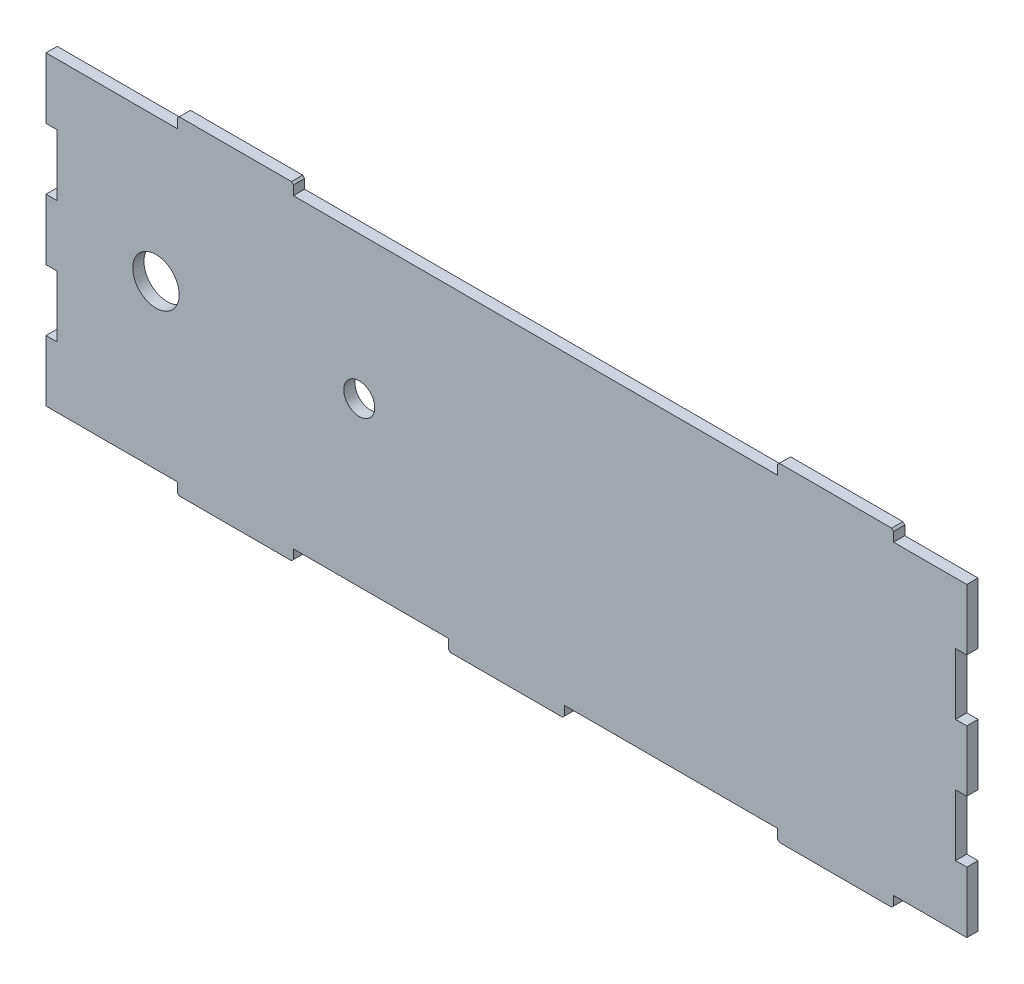
from build123d import *

# Parameters (mm, degrees)
SKETCH1_R           = 6
SKETCH1_R_2         = 4
BOSS_EXTRUDE1_DEPTH = 2.9


with BuildPart() as part:
    # Sketch1 → Boss-Extrude1 (new body)
    with BuildSketch(Plane.XY.offset(-137.9)):
        Polygon((118.9, 2.9), (100, 2.9), (100, 0.5), (99.5, 0), (70.5, 0), (70, 0.5), (70, 2.9), (15, 2.9), (15, 0.5), (14.5, 0), (-14.5, 0), (-15, 0.5), (-15, 2.9), (-55, 2.9), (-55, 0.5), (-55.5, 0), (-84.5, 0), (-85, 0.5), (-85, 2.9), (-118.9, 2.9), (-118.9, 18.675), (-116, 18.675), (-116, 34.525), (-118.9, 34.525), (-118.9, 50.275), (-116, 50.275), (-116, 66.125), (-118.9, 66.125), (-118.9, 81.9), (-85, 81.9), (-85, 84.3), (-84.5, 84.8), (-55.5, 84.8), (-55, 84.3), (-55, 81.9), (70, 81.9), (70, 84.3), (70.5, 84.8), (99.5, 84.8), (100, 84.3), (100, 81.9), (118.9, 81.9), (118.9, 66.125), (116, 66.125), (116, 50.275), (118.9, 50.275), (118.9, 34.525), (116, 34.525), (116, 18.675), (118.9, 18.675), align=None)
        with Locations((-90.5, 45)):
            Circle(SKETCH1_R, mode=Mode.SUBTRACT)
        with Locations((-38, 45)):
            Circle(SKETCH1_R_2, mode=Mode.SUBTRACT)
    extrude(amount=BOSS_EXTRUDE1_DEPTH)


solid = part.part
